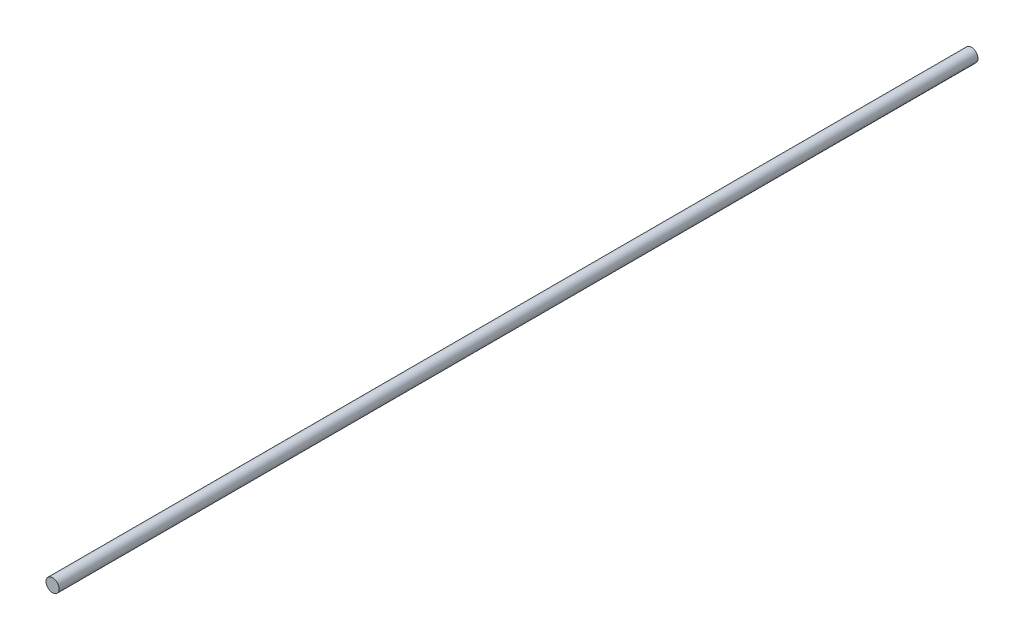
from build123d import *

# Parameters (mm, degrees)
SKETCH1_R           = 2
BOSS_EXTRUDE1_DEPTH = 280


with BuildPart() as part:
    # Sketch1 → Boss-Extrude1 (new body)
    with BuildSketch(Plane.XY):
        Circle(SKETCH1_R)
    extrude(amount=BOSS_EXTRUDE1_DEPTH)


solid = part.part
